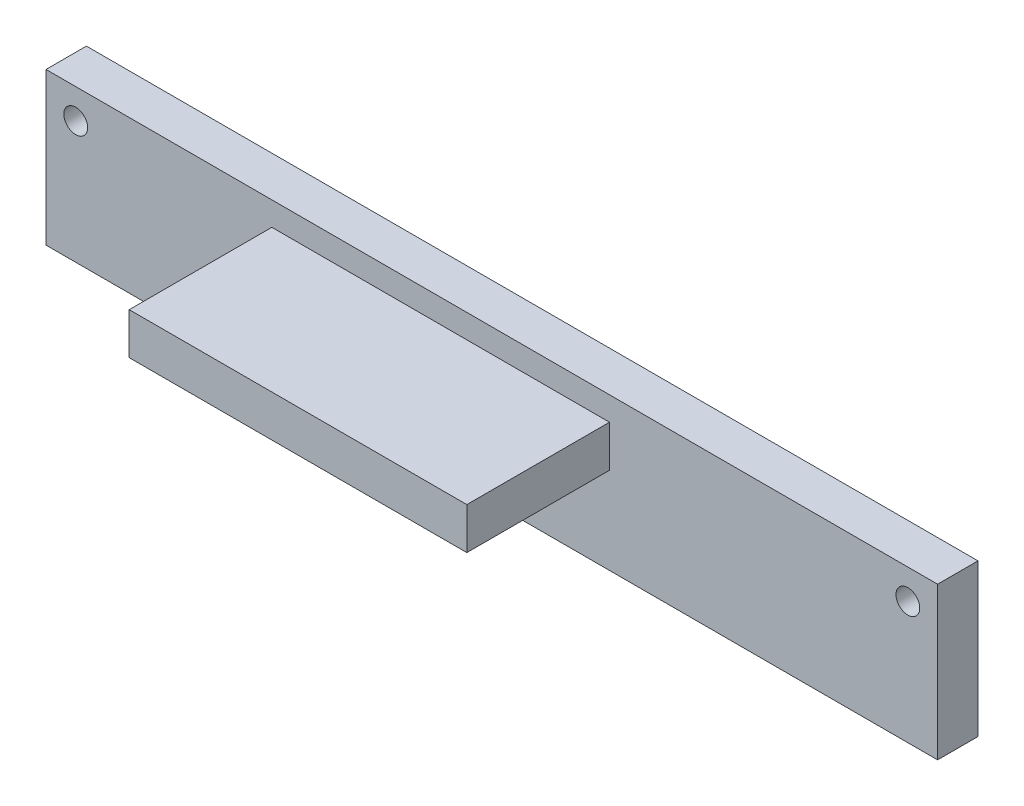
from build123d import *

# Parameters (mm, degrees)
SKETCH1_W           = 75
SKETCH1_H           = 12.8
BOSS_EXTRUDE1_DEPTH = 3.4
SKETCH2_W           = 28.4
SKETCH2_H           = 3.5
BOSS_EXTRUDE2_DEPTH = 12
SKETCH2_3_R         = 1.000959723
SKETCH2_3_R_2       = 1
CUT_EXTRUDE1_DEPTH  = 12


with BuildPart() as part:
    # Sketch1 → Boss-Extrude1 (new body)
    with BuildSketch(Plane.XY):
        with Locations((37.5, 6.4)):
            Rectangle(SKETCH1_W, SKETCH1_H)
    extrude(amount=BOSS_EXTRUDE1_DEPTH)

    # Sketch2 → Boss-Extrude2 (add)
    with BuildSketch(Plane.XY.offset(3.4)):
        with Locations((33.2, 9.05)):
            Rectangle(SKETCH2_W, SKETCH2_H)
    extrude(amount=BOSS_EXTRUDE2_DEPTH)

    # Sketch2<3> → Cut-Extrude1 (cut)
    with BuildSketch(Plane.XY.offset(3.4)):
        with Locations((2.5, 10.3)):
            Circle(SKETCH2_3_R)
        with Locations((72.5, 10.3)):
            Circle(SKETCH2_3_R_2)
    extrude(amount=-CUT_EXTRUDE1_DEPTH, mode=Mode.SUBTRACT)


solid = part.part
